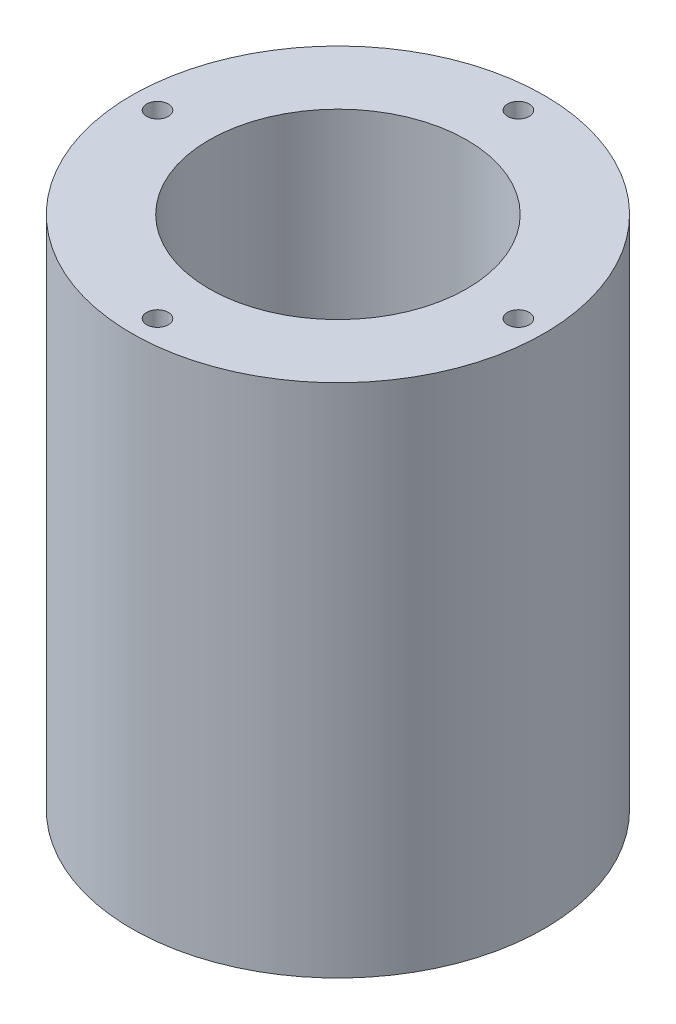
from build123d import *

# Parameters (mm, degrees)
SKETCH1_R           = 40
SKETCH1_R_2         = 25
BOSS_EXTRUDE1_DEPTH = 50
SKETCH2_R           = 2.1
CUT_EXTRUDE1_DEPTH  = 10
BOSS_EXTRUDE2_START = -50
BOSS_EXTRUDE2_DEPTH = 12
BOSS_EXTRUDE3_START = -7
SKETCH4_R           = 15
SKETCH4_R_2         = 11.1
BOSS_EXTRUDE3_DEPTH = 7
BOSS_EXTRUDE4_START = 10
SKETCH5_R           = 15
SKETCH5_R_2         = 9
BOSS_EXTRUDE4_DEPTH = 10
BOSS_EXTRUDE5_START = 7
SKETCH6_R           = 15
SKETCH6_R_2         = 11.1
BOSS_EXTRUDE5_DEPTH = 7
FILLET1_R           = 2


with BuildPart() as part:
    # Sketch1 → Boss-Extrude1 (new, symmetric)
    with BuildSketch(Plane(origin=(0, 0, 0), x_dir=(1, 0, 0), z_dir=(0, 1, 0))):
        with Locations(Location((0, 0, 0), (0, 0, 90))):
            Circle(SKETCH1_R)
        with Locations(Location((0, 0, 0), (0, 0, 90))):
            Circle(SKETCH1_R_2, mode=Mode.SUBTRACT)
    extrude(amount=BOSS_EXTRUDE1_DEPTH, both=True)

    # Sketch2 → Cut-Extrude1 (cut)
    with BuildSketch(Plane(origin=(0, 50, 0), x_dir=(1, 0, 0), z_dir=(0, 1, 0))):
        with Locations(Location((0, 35, 0), (0, 0, 270))):
            Circle(SKETCH2_R)
        with Locations(Location((35, 0, 0), (0, 0, 270))):
            Circle(SKETCH2_R)
        with Locations(Location((0, -35, 0), (0, 0, 270))):
            Circle(SKETCH2_R)
        with Locations(Location((-35, 0, 0), (0, 0, 270))):
            Circle(SKETCH2_R)
    cut_extrude1 = extrude(amount=-CUT_EXTRUDE1_DEPTH, mode=Mode.SUBTRACT)

    # Mirror1: Cut-Extrude1 across plane
    add(cut_extrude1.mirror(Plane.ZX), mode=Mode.SUBTRACT)

    # Sketch3 → Boss-Extrude2 (add, symmetric)
    with BuildSketch(Plane.XZ.offset(50).offset(BOSS_EXTRUDE2_START)):
        with BuildLine():
            ThreePointArc((-2.604722665, 14.772116295), (-1.307336141, 14.942920471), (0, 15))
            Line((0, 15), (0, 25))
            ThreePointArc((0, 25), (-2.178893569, 24.904867452), (-4.341204442, 24.620193825))
            Line((-4.341204442, 24.620193825), (-2.604722665, 14.772116295))
        make_face()
        with BuildLine():
            Line((0, 25), (0, 15))
            ThreePointArc((0, 15), (1.307336141, 14.942920471), (2.604722665, 14.772116295))
            Line((2.604722665, 14.772116295), (4.341204442, 24.620193825))
            ThreePointArc((4.341204442, 24.620193825), (2.178893569, 24.904867452), (0, 25))
        make_face()
    boss_extrude2 = extrude(amount=BOSS_EXTRUDE2_DEPTH, both=True)

    # Mirror2: Boss-Extrude2 across plane
    add(boss_extrude2.mirror(Plane.XY))

    # Sketch4 → Boss-Extrude3 (add)
    with BuildSketch(Plane(origin=(0, 12, 0), x_dir=(1, 0, 0), z_dir=(0, 1, 0)).offset(BOSS_EXTRUDE3_START)):
        Circle(SKETCH4_R)
        with Locations(Location((0, 0, 0), (0, 0, 270))):
            Circle(SKETCH4_R_2, mode=Mode.SUBTRACT)
    extrude(amount=BOSS_EXTRUDE3_DEPTH)

    # Sketch5 → Boss-Extrude4 (add)
    with BuildSketch(Plane.XZ.offset(-5).offset(BOSS_EXTRUDE4_START)):
        Circle(SKETCH5_R)
        with Locations(Location((0, 0, 0), (0, 0, 270))):
            Circle(SKETCH5_R_2, mode=Mode.SUBTRACT)
    extrude(amount=-BOSS_EXTRUDE4_DEPTH)

    # Sketch6 → Boss-Extrude5 (add)
    with BuildSketch(Plane.XZ.offset(5).offset(BOSS_EXTRUDE5_START)):
        Circle(SKETCH6_R)
        with Locations(Location((0, 0, 0), (0, 0, 90))):
            Circle(SKETCH6_R_2, mode=Mode.SUBTRACT)
    extrude(amount=-BOSS_EXTRUDE5_DEPTH)

    # Fillet1
    fillet1_edges = [part.edges().sort_by_distance(p)[0] for p in [
        (2.604722665, 0, 14.772116295),
        (-2.604722665, 0, 14.772116295),
        (-4.341204442, 0, 24.620193825),
        (4.341204442, 0, 24.620193825),
        (-2.604722665, 0, -14.772116295),
        (2.604722665, 0, -14.772116295),
        (4.341204442, 0, -24.620193825),
        (-4.341204442, 0, -24.620193825),
    ]]
    fillet(fillet1_edges, radius=FILLET1_R)


solid = part.part
